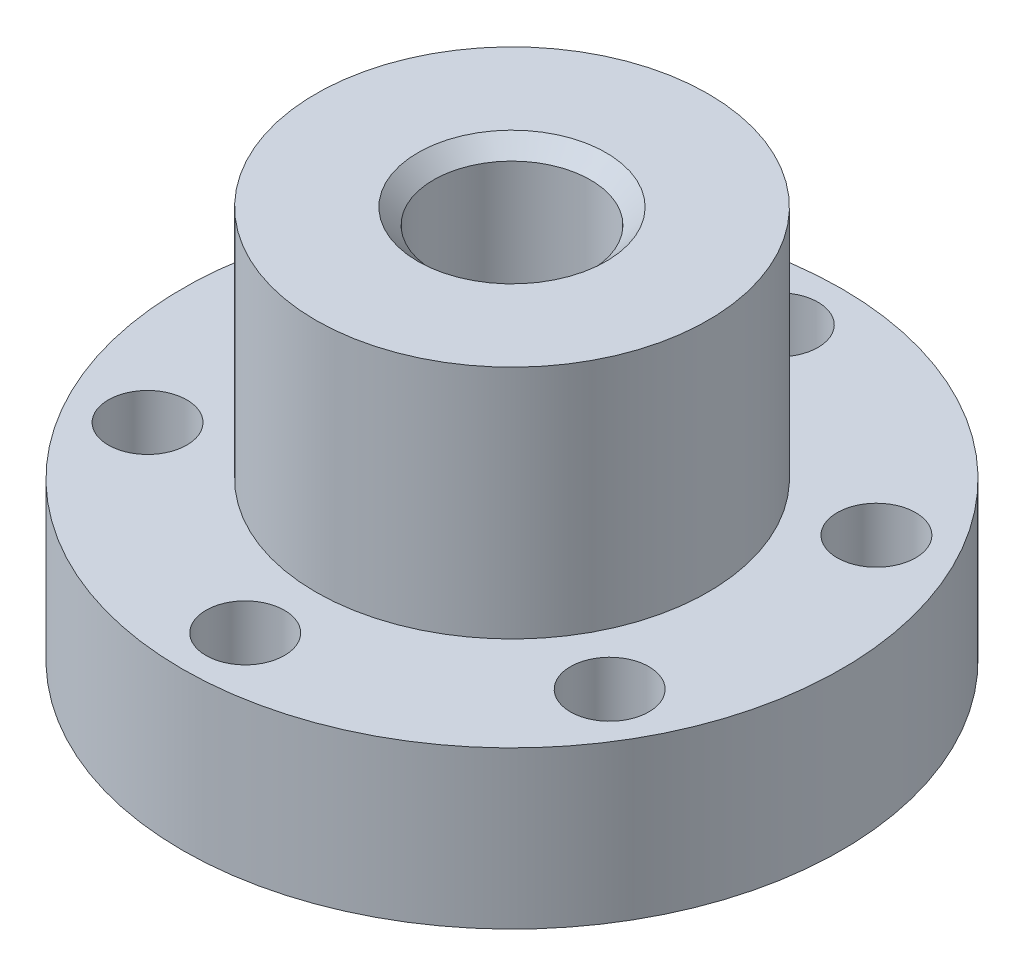
from build123d import *

# Parameters (mm, degrees)
SKETCH1_R           = 21
SKETCH1_R_2         = 2.5
BOSS_EXTRUDE1_DEPTH = 10
SKETCH2_R           = 12.5
BOSS_EXTRUDE2_DEPTH = 15
SKETCH3_R           = 5
CUT_EXTRUDE1_DEPTH  = 39.820097888
CHAMFER1_SIZE       = 1


with BuildPart() as part:
    # Sketch1 → Boss-Extrude1 (new body)
    with BuildSketch(Plane(origin=(0, 0, 0), x_dir=(1, 0, 0), z_dir=(0, 1, 0))):
        with Locations(Location((0, 0, 0), (0, 0, 270))):
            Circle(SKETCH1_R)
        with Locations(Location((0, 17, 0), (0, 0, 270))):
            Circle(SKETCH1_R_2, mode=Mode.SUBTRACT)
        with Locations(Location((14.722431864, 8.5, 0), (0, 0, 270))):
            Circle(SKETCH1_R_2, mode=Mode.SUBTRACT)
        with Locations(Location((14.722431864, -8.5, 0), (0, 0, 270))):
            Circle(SKETCH1_R_2, mode=Mode.SUBTRACT)
        with Locations(Location((0, -17, 0), (0, 0, 270))):
            Circle(SKETCH1_R_2, mode=Mode.SUBTRACT)
        with Locations(Location((-14.722431864, -8.5, 0), (0, 0, 270))):
            Circle(SKETCH1_R_2, mode=Mode.SUBTRACT)
        with Locations(Location((-14.722431864, 8.5, 0), (0, 0, 270))):
            Circle(SKETCH1_R_2, mode=Mode.SUBTRACT)
    extrude(amount=BOSS_EXTRUDE1_DEPTH)

    # Sketch2 → Boss-Extrude2 (add)
    with BuildSketch(Plane(origin=(0, 10, 0), x_dir=(1, 0, 0), z_dir=(0, 1, 0))):
        with Locations(Location((0, 0, 0), (0, 0, 270))):
            Circle(SKETCH2_R)
    extrude(amount=BOSS_EXTRUDE2_DEPTH)

    # Sketch3 → Cut-Extrude1 (cut, through all)
    with BuildSketch(Plane(origin=(0, 25, 0), x_dir=(1, 0, 0), z_dir=(0, 1, 0))):
        with Locations(Location((0, 0, 0), (0, 0, 270))):
            Circle(SKETCH3_R)
    extrude(amount=-CUT_EXTRUDE1_DEPTH, mode=Mode.SUBTRACT)

    # Chamfer1
    chamfer1_edges = [part.edges().sort_by_distance(p)[0] for p in [
        (0, 0, -5),
        (0, 25, -5),
    ]]
    chamfer(chamfer1_edges, length=CHAMFER1_SIZE)


solid = part.part
